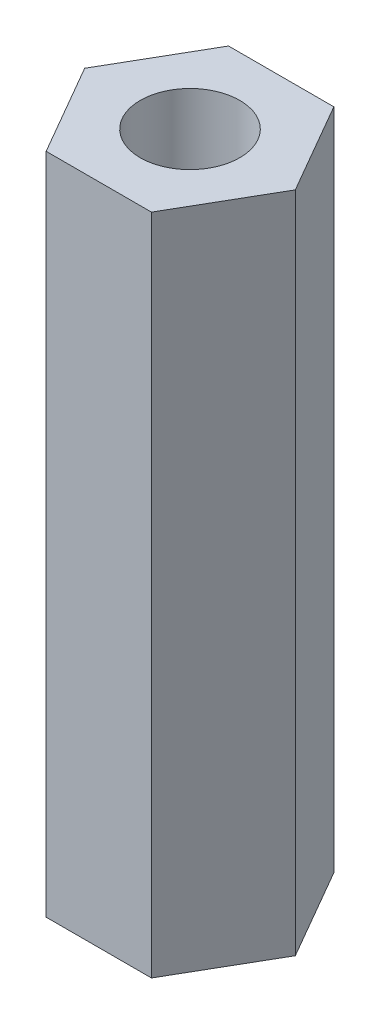
from build123d import *

# Parameters (mm, degrees)
SKETCH_1_R      = 1.5
EXTRUDE_1_DEPTH = 20


with BuildPart() as part:
    # 草图1 → 凸台-拉伸1 (new body)
    with BuildSketch(Plane(origin=(0, 0, 0), x_dir=(1, 0, 0), z_dir=(0, 1, 0))):
        Polygon((-4.147179809, 7.572240595), (-5.734893049, 10.322240595), (-8.91031953, 10.322240595), (-10.49803277, 7.572240595), (-8.91031953, 4.822240595), (-5.734893049, 4.822240595), align=None)
        with Locations(Location((-7.322606289, 7.572240595, 0), (0, 0, 270))):
            Circle(SKETCH_1_R, mode=Mode.SUBTRACT)
    extrude(amount=EXTRUDE_1_DEPTH)


solid = part.part
